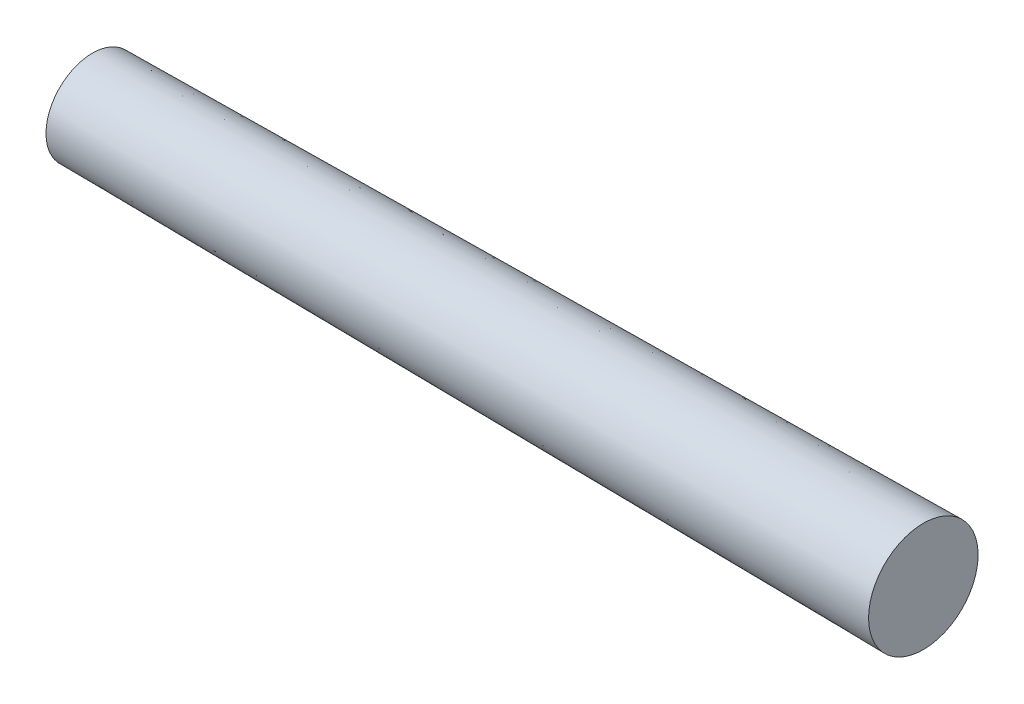
from build123d import *


with BuildPart() as part:
    # Sketch1 → Revolve1 (revolve)
    with BuildSketch(Plane.XY, mode=Mode.PRIVATE) as revolve1_sk:
        Polygon((110, 7.25), (0, 6.15), (0, 0), (110, 0), align=None)
    revolve(revolve1_sk.sketch.rotate(Axis((0, 0, 0), (1, 0, 0)), 90), axis=Axis((0, 0, 0), (1, 0, 0)))


solid = part.part
